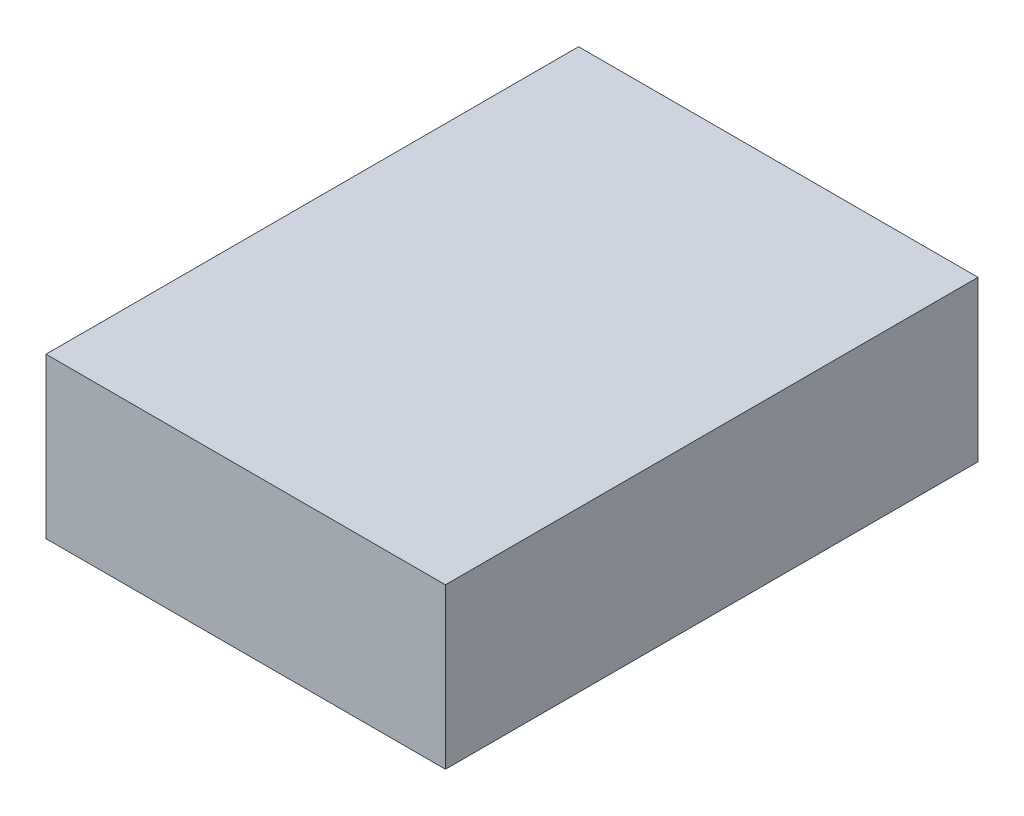
from build123d import *

# Parameters (mm, degrees)
SKETCH5_W           = 15
SKETCH5_H           = 20
BOSS_EXTRUDE2_DEPTH = 6


with BuildPart() as part:
    # Sketch5 → Boss-Extrude2 (new body)
    with BuildSketch(Plane(origin=(0, 0, 0), x_dir=(1, 0, 0), z_dir=(0, 1, 0))):
        with Locations((7.5, 10)):
            Rectangle(SKETCH5_W, SKETCH5_H)
    extrude(amount=BOSS_EXTRUDE2_DEPTH)


solid = part.part
